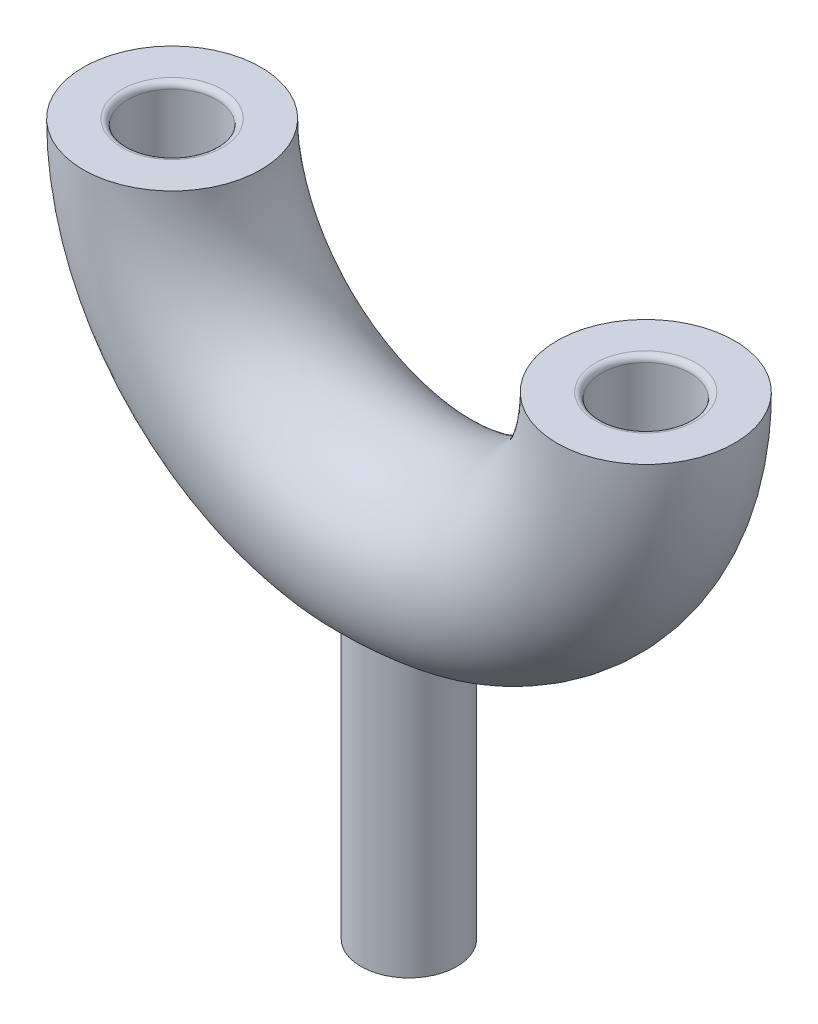
from build123d import *
from build123d.topology import SkipClean

# Parameters (mm, degrees)
SKETCH2_R               = 10.287
BOSS_EXTRUDE1_DEPTH     = 76.2
SWEEP1_PROFILE_R        = 19.05
SKETCH10_W              = 148.15790326
SKETCH10_H              = 49.47754936
SKETCH10_R              = 10.287
CUT_EXTRUDE1_DEPTH      = 63.5
FILLET1_R               = 2.54
CUT_EXTRUDE2_DEPTH      = 63.5
CUT_EXTRUDE2_DEPTH_BACK = 63.5
SKETCH11_W              = 184.531280221
SKETCH11_H              = 85.52478337
SKETCH12_R              = 9.525
CUT_EXTRUDE3_DEPTH      = 19.05
FILLET2_R               = 1.27


with BuildPart() as part:
    # Sketch2 → Boss-Extrude1 (new body)
    with BuildSketch(Plane(origin=(0, 0, 0), x_dir=(1, 0, 0), z_dir=(0, 1, 0))):
        Circle(SKETCH2_R)
    extrude(amount=BOSS_EXTRUDE1_DEPTH)

    # Sweep1: sweep along a path in Sketch3
    with SkipClean():  # the faces are left unmerged after this step: merging them gives an invalid solid
        with BuildLine(Plane.XY) as sweep1_path:
            CenterArc((0, 127), 50.8, 0, 360)
        # Sweep1 profile (on start of the path) → Sweep1 (sweep)
        with BuildSketch(Plane(origin=(50.8, 127, 0), x_dir=(0, 0, 1), z_dir=(0, 1, 0))):
            Circle(SWEEP1_PROFILE_R)
        sweep(path=sweep1_path.line)

    # Sketch10 → Cut-Extrude1 (cut)
    with BuildSketch(Plane(origin=(0, 0, 0), x_dir=(1, 0, 0), z_dir=(0, 1, 0))):
        Rectangle(SKETCH10_W, SKETCH10_H)
        Circle(SKETCH10_R, mode=Mode.SUBTRACT)
    extrude(amount=CUT_EXTRUDE1_DEPTH, mode=Mode.SUBTRACT)

    # Fillet1
    fillet1_edges = [part.edges().sort_by_distance(p)[0] for p in [
        (9.536798122, 63.5, 13.528365302),
    ]]
    fillet(fillet1_edges, radius=FILLET1_R)

    # Sketch11 → Cut-Extrude2 (cut, two sides: drawn at the far end of the back side and taken through both)
    with BuildSketch(Plane.XY.offset(-CUT_EXTRUDE2_DEPTH_BACK)):
        with Locations((2.628650716, 169.762391685)):
            Rectangle(SKETCH11_W, SKETCH11_H)
    extrude(amount=CUT_EXTRUDE2_DEPTH + CUT_EXTRUDE2_DEPTH_BACK, mode=Mode.SUBTRACT)

    # Sketch12 → Cut-Extrude3 (cut)
    with BuildSketch(Plane(origin=(0, 127, 0), x_dir=(1, 0, 0), z_dir=(0, 1, 0))):
        with Locations((50.8, 0)):
            Circle(SKETCH12_R)
        with Locations((-50.8, 0)):
            Circle(SKETCH12_R)
    extrude(amount=-CUT_EXTRUDE3_DEPTH, mode=Mode.SUBTRACT)

    # Fillet2
    fillet2_edges = [part.edges().sort_by_distance(p)[0] for p in [
        (41.275, 127, 0),
        (-60.325, 127, 0),
    ]]
    fillet(fillet2_edges, radius=FILLET2_R)


solid = part.part
